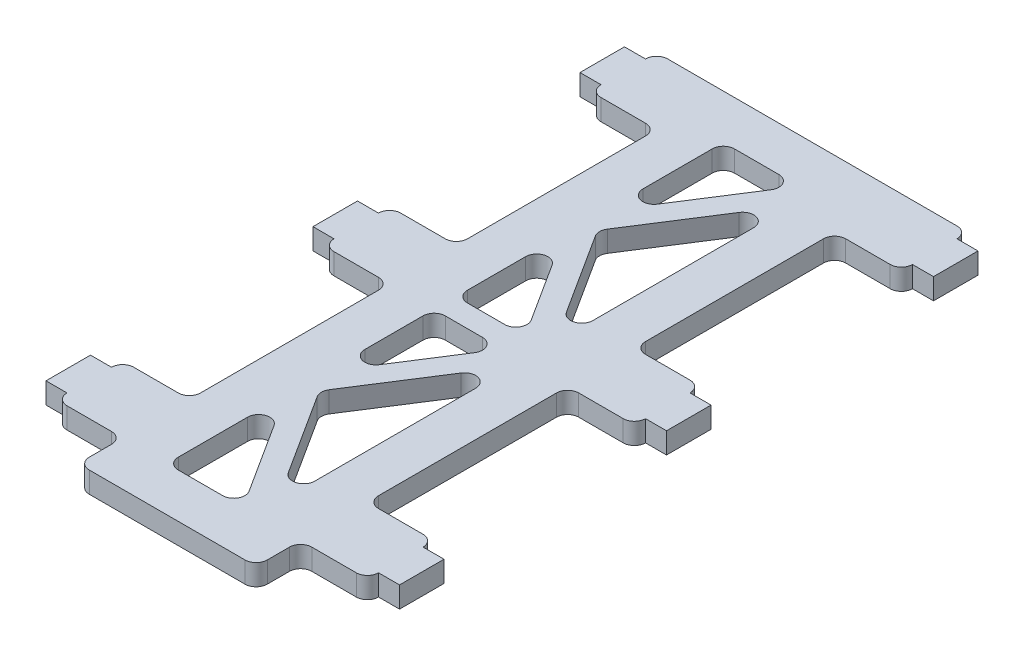
from build123d import *

# Parameters (mm, degrees)
SKETCH1_W           = 25.4
SKETCH1_H           = 92.075
BOSS_EXTRUDE1_DEPTH = 1.5
SKETCH2_W           = 9.525
SKETCH2_H           = 9.525
BOSS_EXTRUDE2_DEPTH = 3
CUT_EXTRUDE1_DEPTH  = 169.189397054
FILLET1_R           = 1.5875
SKETCH5_W           = 3
SKETCH5_H           = 6.35
BOSS_EXTRUDE3_DEPTH = 3


with BuildPart() as part:
    # Sketch1 → Boss-Extrude1 (new, symmetric)
    with BuildSketch(Plane(origin=(0, 34.29, 0), x_dir=(1, 0, 0), z_dir=(0, 1, 0))):
        with Locations((0, 120.65)):
            Rectangle(SKETCH1_W, SKETCH1_H)
    extrude(amount=BOSS_EXTRUDE1_DEPTH, both=True)

    # Sketch2 → Boss-Extrude2 (add)
    with BuildSketch(Plane(origin=(0, 35.79, 0), x_dir=(1, 0, 0), z_dir=(0, 1, 0))):
        with Locations((17.4625, 161.925)):
            Rectangle(SKETCH2_W, SKETCH2_H)
        with Locations((-17.4625, 161.925)):
            Rectangle(SKETCH2_W, SKETCH2_H)
        with Locations((17.4625, 123.825)):
            Rectangle(SKETCH2_W, SKETCH2_H)
        with Locations((-17.4625, 123.825)):
            Rectangle(SKETCH2_W, SKETCH2_H)
        with Locations((17.4625, 85.725)):
            Rectangle(SKETCH2_W, SKETCH2_H)
        with Locations((-17.4625, 85.725)):
            Rectangle(SKETCH2_W, SKETCH2_H)
    extrude(amount=-BOSS_EXTRUDE2_DEPTH)

    # Sketch4 → Cut-Extrude1 (cut, through all)
    with BuildSketch(Plane(origin=(0, 35.79, 0), x_dir=(1, 0, 0), z_dir=(0, 1, 0))):
        Polygon((4.465215596, 80.9625), (-6.35, 97.861274369), (-6.35, 80.9625), align=None)
        Polygon((6.35, 83.907475631), (6.35, 117.705024369), (-4.465215596, 100.80625), align=None)
        Polygon((3.449215596, 119.0625), (-6.35, 119.0625), (-6.35, 103.751225631), align=None)
        Polygon((3.449215596, 122.2375), (-6.35, 137.548774369), (-6.35, 122.2375), align=None)
        Polygon((6.35, 123.594975631), (6.35, 157.392524369), (-4.465215596, 140.49375), align=None)
        Polygon((4.465215596, 160.3375), (-6.35, 160.3375), (-6.35, 143.438725631), align=None)
    extrude(amount=-CUT_EXTRUDE1_DEPTH, mode=Mode.SUBTRACT)

    # Fillet1
    fillet1_edges = [part.edges().sort_by_distance(p)[0] for p in [
        (3.449215596, 34.29, -119.0625),
        (-6.35, 34.29, -103.751225631),
        (-6.35, 34.29, -119.0625),
        (-4.465215596, 34.29, -100.80625),
        (6.35, 34.29, -117.705024369),
        (6.35, 34.29, -83.907475631),
        (-4.465215596, 34.29, -140.49375),
        (6.35, 34.29, -157.392524369),
        (6.35, 34.29, -123.594975631),
        (3.449215596, 34.29, -122.2375),
        (-6.35, 34.29, -122.2375),
        (-6.35, 34.29, -137.548774369),
        (-6.35, 34.29, -143.438725631),
        (-6.35, 34.29, -160.3375),
        (4.465215596, 34.29, -160.3375),
        (4.465215596, 34.29, -80.9625),
        (-6.35, 34.29, -80.9625),
        (-6.35, 34.29, -97.861274369),
        (22.225, 34.29, -80.9625),
        (22.225, 34.29, -90.4875),
        (12.7, 34.29, -90.4875),
        (12.7, 34.29, -80.9625),
        (-12.7, 34.29, -119.0625),
        (-12.7, 34.29, -128.5875),
        (-22.225, 34.29, -128.5875),
        (-22.225, 34.29, -119.0625),
        (22.225, 34.29, -119.0625),
        (22.225, 34.29, -128.5875),
        (12.7, 34.29, -128.5875),
        (12.7, 34.29, -119.0625),
        (-12.7, 34.29, -157.1625),
        (-22.225, 34.29, -166.6875),
        (-22.225, 34.29, -157.1625),
        (-12.7, 34.29, -80.9625),
        (-12.7, 34.29, -90.4875),
        (-22.225, 34.29, -90.4875),
        (-22.225, 34.29, -80.9625),
        (22.225, 34.29, -157.1625),
        (22.225, 34.29, -166.6875),
        (12.7, 34.29, -157.1625),
        (-12.7, 34.29, -74.6125),
        (12.7, 34.29, -74.6125),
    ]]
    fillet(fillet1_edges, radius=FILLET1_R)

    # Sketch5 → Boss-Extrude3 (add)
    with BuildSketch(Plane(origin=(0, 35.79, 0), x_dir=(1, 0, 0), z_dir=(0, 1, 0))):
        with Locations((23.725, 161.925)):
            Rectangle(SKETCH5_W, SKETCH5_H)
        with Locations((-23.725, 161.925)):
            Rectangle(SKETCH5_W, SKETCH5_H)
        with Locations((23.725, 123.825)):
            Rectangle(SKETCH5_W, SKETCH5_H)
        with Locations((-23.725, 123.825)):
            Rectangle(SKETCH5_W, SKETCH5_H)
        with Locations((23.725, 85.725)):
            Rectangle(SKETCH5_W, SKETCH5_H)
        with Locations((-23.725, 85.725)):
            Rectangle(SKETCH5_W, SKETCH5_H)
    extrude(amount=-BOSS_EXTRUDE3_DEPTH)


solid = part.part
